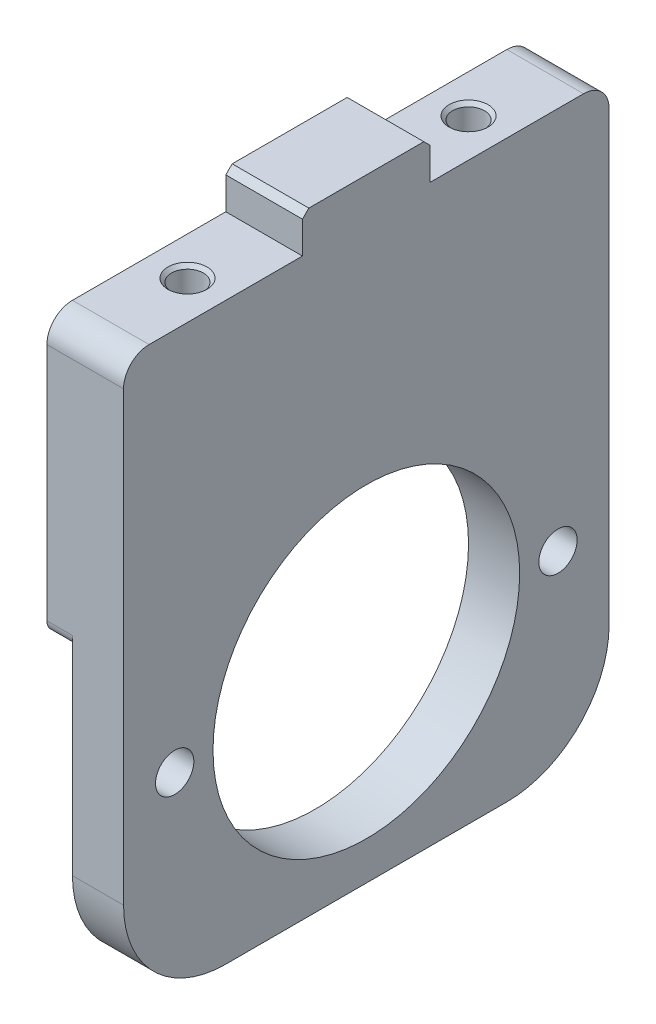
from build123d import *

# Parameters (mm, degrees)
SKETCH_1_W                   = 38
SKETCH_1_H                   = 45
EXTRUDE_1_DEPTH              = 6
SKETCH_2_R                   = 12
SKETCH_2_R_2                 = 1.5
CUT_EXTRUDE_1_DEPTH          = 31.054117854
CUT_EXTRUDE_2_DEPTH          = 2
FILLET_2_R                   = 1
FILLET_3_R                   = 8
FILLET_4_R                   = 2
SKETCH_4_W                   = 10
SKETCH_4_H                   = 3
EXTRUDE_2_DEPTH              = 6
CHAMFER_1_SIZE               = 0.5
HOLE_WIZARD_M3_1_D           = 2.5
HOLE_WIZARD_M3_1_DEPTH       = 7.5
HOLE_WIZARD_M3_1_CSINK_D     = 3.05
HOLE_WIZARD_M3_1_CSINK_ANGLE = 90
HOLE_WIZARD_M3_1_TIP         = 0.751075774


with BuildPart() as part:
    # 草图1 → 凸台-拉伸1 (new body)
    with BuildSketch(Plane(origin=(0, 0, 0), x_dir=(0, 0, -1), z_dir=(1, 0, 0))):
        Rectangle(SKETCH_1_W, SKETCH_1_H)
    extrude(amount=EXTRUDE_1_DEPTH)

    # 草图2 → 切除-拉伸1 (cut, through all)
    with BuildSketch(Plane.ZY):
        with Locations((0, -7.5)):
            Circle(SKETCH_2_R)
        with Locations((15, -7.5)):
            Circle(SKETCH_2_R_2)
        with Locations(Location((-15, -7.5, 0), (0, 0, 180))):
            Circle(SKETCH_2_R_2)
    extrude(amount=-CUT_EXTRUDE_1_DEPTH, mode=Mode.SUBTRACT)

    # 草图3 → 切除-拉伸2 (cut)
    with BuildSketch(Plane.ZY):
        with BuildLine():
            Line((19.25, -7.5), (19.25, -22.5))
            Line((19.25, -22.5), (-19.25, -22.5))
            Line((-19.25, -22.5), (-19.25, -7.5))
            ThreePointArc((-19.25, -7.5), (0, 11.75), (19.25, -7.5))
        make_face()
    extrude(amount=-CUT_EXTRUDE_2_DEPTH, mode=Mode.SUBTRACT)

    # 圆角2
    fillet_2_edges = [part.edges().sort_by_distance(p)[0] for p in [
        (1, -4.407670781, -19),
        (1, -4.407670781, 19),
    ]]
    fillet(fillet_2_edges, radius=FILLET_2_R)

    # 圆角3
    fillet_3_edges = [part.edges().sort_by_distance(p)[0] for p in [
        (4, -22.5, -19),
        (4, -22.5, 19),
    ]]
    fillet(fillet_3_edges, radius=FILLET_3_R)

    # 圆角4
    fillet_4_edges = [part.edges().sort_by_distance(p)[0] for p in [
        (3, 22.5, 19),
        (3, 22.5, -19),
    ]]
    fillet(fillet_4_edges, radius=FILLET_4_R)

    # 草图4 → 凸台-拉伸2 (add)
    with BuildSketch(Plane.ZY):
        with Locations((0, 24)):
            Rectangle(SKETCH_4_W, SKETCH_4_H)
    extrude(amount=-EXTRUDE_2_DEPTH)

    # 倒角1
    chamfer_1_edges = [part.edges().sort_by_distance(p)[0] for p in [
        (3, 25.5, 5),
        (3, 25.5, -5),
    ]]
    chamfer(chamfer_1_edges, length=CHAMFER_1_SIZE)

    # M3 螺纹孔1
    with Locations(Plane(origin=(3, 22.5, -11), x_dir=(0, 0, 1), z_dir=(0, 1, 0))):
        with Locations((0, 0), (22, 0)):
            CounterSinkHole(HOLE_WIZARD_M3_1_D / 2, HOLE_WIZARD_M3_1_CSINK_D / 2, depth=HOLE_WIZARD_M3_1_DEPTH, counter_sink_angle=HOLE_WIZARD_M3_1_CSINK_ANGLE)
            with Locations((0, 0, -(HOLE_WIZARD_M3_1_DEPTH + HOLE_WIZARD_M3_1_TIP / 2))):  # 118° drill point
                Cone(0, HOLE_WIZARD_M3_1_D / 2, HOLE_WIZARD_M3_1_TIP, mode=Mode.SUBTRACT)


solid = part.part
